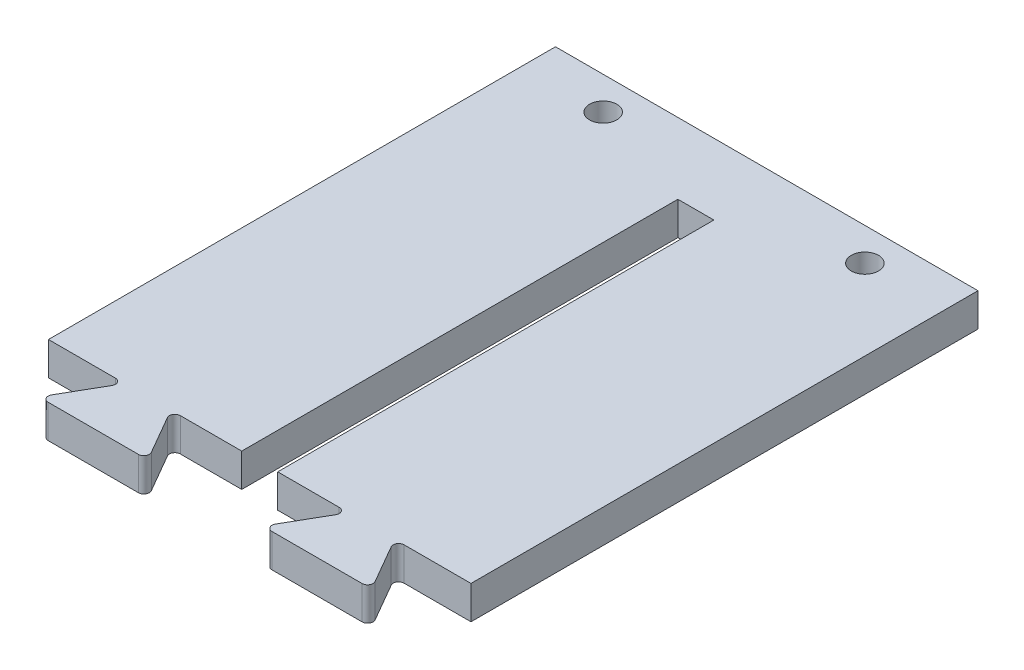
from build123d import *

# Parameters (mm, degrees)
BOSS_EXTRUDE1_DEPTH      = 3.05
FILLET1_R                = 0.5
SKETCH3_W                = 3.3
SKETCH3_H                = 40
SKETCH3_H_2              = 1
CUT_EXTRUDE2_DEPTH       = 51.467248043
M3_TAPPED_DAMPER_HOLES_D = 2.5


with BuildPart() as part:
    # Sketch1 → Boss-Extrude1 (new body)
    with BuildSketch(Plane(origin=(0, 0, 0), x_dir=(1, 0, 0), z_dir=(0, 1, 0))):
        Polygon((-19.375, 0), (-19.375, 46.5), (19.375, 46.5), (19.375, 0), (12.375, 0), (15.261751346, -5), (5.261751346, -5), (8.148502692, 0), (-8.148502692, 0), (-5.261751346, -5), (-15.261751346, -5), (-12.375, 0), align=None)
    extrude(amount=BOSS_EXTRUDE1_DEPTH)

    # Fillet1
    fillet1_edges = [part.edges().sort_by_distance(p)[0] for p in [
        (12.375, 1.525, 0),
        (15.261751346, 1.525, 5),
        (5.261751346, 1.525, 5),
        (8.148502692, 1.525, 0),
        (-8.148502692, 1.525, 0),
        (-5.261751346, 1.525, 5),
        (-15.261751346, 1.525, 5),
        (-12.375, 1.525, 0),
    ]]
    fillet(fillet1_edges, radius=FILLET1_R)

    # Sketch3 → Cut-Extrude2 (cut, through all)
    with BuildSketch(Plane(origin=(0, 3.05, 0), x_dir=(1, 0, 0), z_dir=(0, 1, 0))):
        with Locations((0, 20)):
            Rectangle(SKETCH3_W, SKETCH3_H)
        with Locations((0, -1.7)):
            Rectangle(SKETCH3_W, SKETCH3_H_2)
    extrude(amount=-CUT_EXTRUDE2_DEPTH, mode=Mode.SUBTRACT)

    # M3 Tapped Damper Holes (through all)
    with Locations(Plane(origin=(0, 3.05, 0), x_dir=(1, 0, 0), z_dir=(0, 1, 0))):
        with Locations((-12, 43.5), (12, 43.5)):
            Hole(M3_TAPPED_DAMPER_HOLES_D / 2)


solid = part.part
